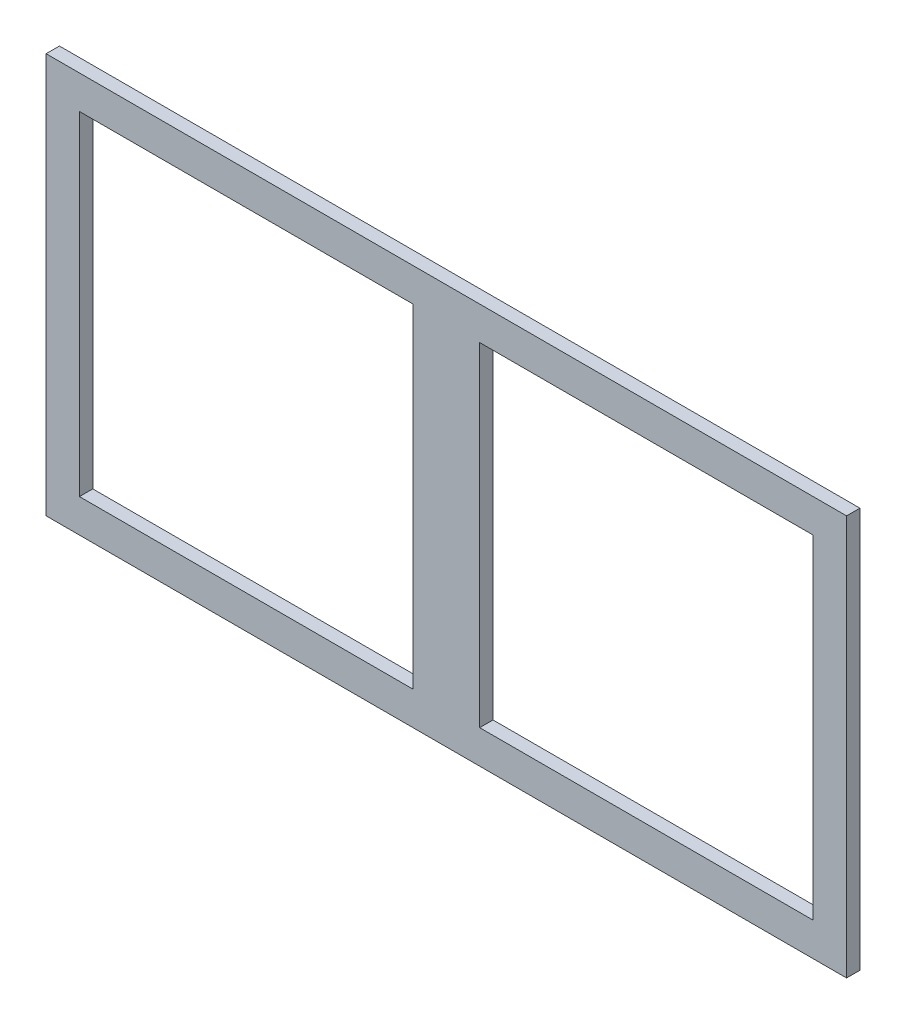
from build123d import *

# Parameters (mm, degrees)
SKIZZE1_W                       = 300
SKIZZE1_H                       = 150
AUFSATZ_LINEAR_AUSTRAGEN1_DEPTH = 5
SKIZZE3_W                       = 125
SKIZZE3_H                       = 125
SCHNITT_LINEAR_AUSTRAGEN1_DEPTH = 213.190951739


with BuildPart() as part:
    # Skizze1 → Aufsatz-Linear austragen1 (new body)
    with BuildSketch(Plane.XY):
        with Locations((0, 75)):
            Rectangle(SKIZZE1_W, SKIZZE1_H)
    extrude(amount=AUFSATZ_LINEAR_AUSTRAGEN1_DEPTH)

    # Skizze3 → Schnitt-Linear austragen1 (cut, through all)
    with BuildSketch(Plane.XY.offset(5)):
        with Locations((-75, 75)):
            Rectangle(SKIZZE3_W, SKIZZE3_H)
        with Locations((75, 75)):
            Rectangle(SKIZZE3_W, SKIZZE3_H)
    extrude(amount=-SCHNITT_LINEAR_AUSTRAGEN1_DEPTH, mode=Mode.SUBTRACT)


solid = part.part
